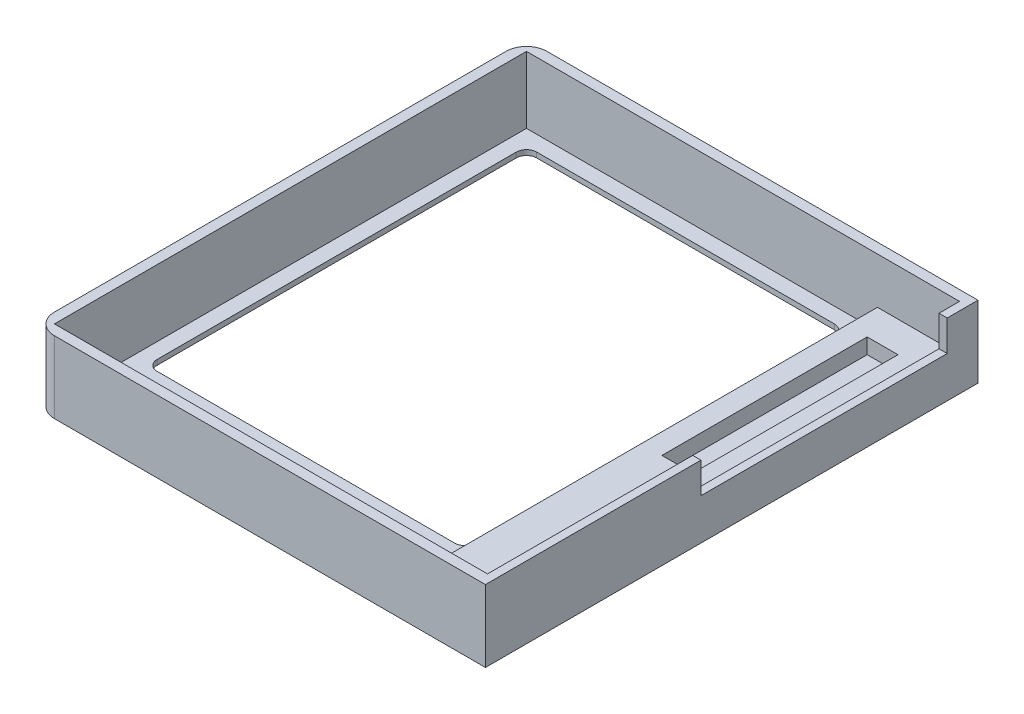
from build123d import *

# Parameters (mm, degrees)
SKETCH1_W           = 44
SKETCH1_H           = 48
BOSS_EXTRUDE1_DEPTH = 7
SKETCH2_W           = 42.2
SKETCH2_H           = 46
CUT_EXTRUDE1_DEPTH  = 6.5
CUT_EXTRUDE2_REACH  = 67.439
SKETCH3_W           = 31
SKETCH3_H           = 37
SKETCH4_W           = 8
SKETCH4_H           = 46
BOSS_EXTRUDE2_DEPTH = 2
SKETCH5_W           = 0.8
SKETCH5_H           = 24
CUT_EXTRUDE3_DEPTH  = 3
FILLET1_R           = 2
FILLET2_R           = 1
SKETCH6_W           = 3
SKETCH6_H           = 20
CUT_EXTRUDE4_DEPTH  = 1.5


with BuildPart() as part:
    # Sketch1 → Boss-Extrude1 (new body)
    with BuildSketch(Plane(origin=(0, 0, 0), x_dir=(1, 0, 0), z_dir=(0, 1, 0))):
        with Locations((22, 24)):
            Rectangle(SKETCH1_W, SKETCH1_H)
    extrude(amount=BOSS_EXTRUDE1_DEPTH)

    # Sketch2 → Cut-Extrude1 (cut)
    with BuildSketch(Plane(origin=(0, 7, 0), x_dir=(1, 0, 0), z_dir=(0, 1, 0))):
        with Locations((22.1, 24)):
            Rectangle(SKETCH2_W, SKETCH2_H)
    extrude(amount=-CUT_EXTRUDE1_DEPTH, mode=Mode.SUBTRACT)

    # Sketch3 → Cut-Extrude2 (cut, up to next)
    with BuildSketch(Plane(origin=(0, 0.5, 0), x_dir=(1, 0, 0), z_dir=(0, 1, 0)), mode=Mode.PRIVATE) as cut_extrude2_sk1:
        with Locations((18, 27)):
            Rectangle(SKETCH3_W, SKETCH3_H)
    cut_extrude2_tool1 = extrude(cut_extrude2_sk1.sketch, amount=-CUT_EXTRUDE2_REACH, mode=Mode.PRIVATE) & part.part
    add(cut_extrude2_tool1.solids().sort_by_distance((18, 0.5, -27))[0], mode=Mode.SUBTRACT)

    # Sketch4 → Boss-Extrude2 (add)
    with BuildSketch(Plane(origin=(0, 0.5, 0), x_dir=(1, 0, 0), z_dir=(0, 1, 0))):
        with Locations((39.2, 24)):
            Rectangle(SKETCH4_W, SKETCH4_H)
    extrude(amount=BOSS_EXTRUDE2_DEPTH)

    # Sketch5 → Cut-Extrude3 (cut)
    with BuildSketch(Plane(origin=(0, 7, 0), x_dir=(1, 0, 0), z_dir=(0, 1, 0))):
        with Locations((43.6, 33)):
            Rectangle(SKETCH5_W, SKETCH5_H)
    extrude(amount=-CUT_EXTRUDE3_DEPTH, mode=Mode.SUBTRACT)

    # Fillet1
    fillet1_edges = [part.edges().sort_by_distance(p)[0] for p in [
        (0, 3.5, -48),
        (0, 3.5, 0),
    ]]
    fillet(fillet1_edges, radius=FILLET1_R)

    # Fillet2
    fillet2_edges = [part.edges().sort_by_distance(p)[0] for p in [
        (2.5, 0.25, -8.5),
        (2.5, 0.25, -45.5),
        (33.5, 0.25, -45.5),
        (33.5, 0.25, -8.5),
    ]]
    fillet(fillet2_edges, radius=FILLET2_R)

    # Sketch6 → Cut-Extrude4 (cut)
    with BuildSketch(Plane(origin=(0, 2.5, 0), x_dir=(1, 0, 0), z_dir=(0, 1, 0))):
        with Locations((38.7, 34)):
            Rectangle(SKETCH6_W, SKETCH6_H)
    extrude(amount=-CUT_EXTRUDE4_DEPTH, mode=Mode.SUBTRACT)


solid = part.part
